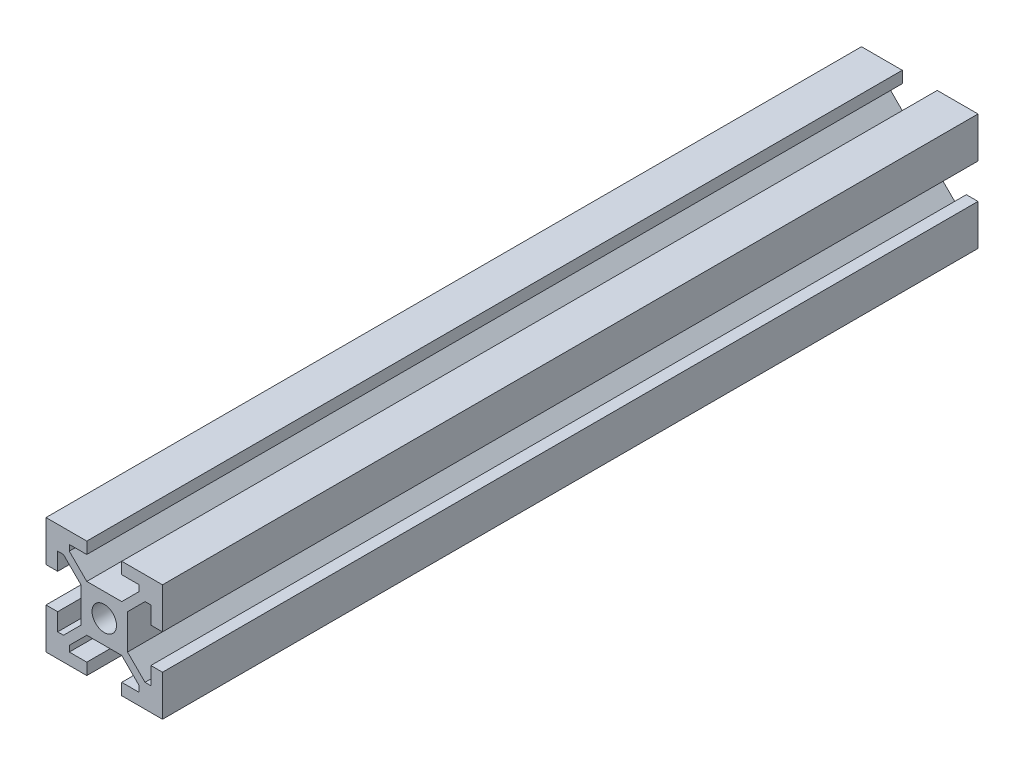
from build123d import *

# Parameters (mm, degrees)
SKETCH_2_R      = 2.1
EXTRUDE_1_DEPTH = 140


with BuildPart() as part:
    # ｽｹｯﾁ2 → ﾎﾞｽ - 押し出し1 (new body)
    with BuildSketch(Plane.XY):
        Polygon((3, 4), (-3, 4), (-6, 7), (-6, 8), (-3, 8), (-3, 10), (-10, 10), (-10, 3), (-8, 3), (-8, 6), (-7, 6), (-4, 3), (-4, -3), (-7, -6), (-8, -6), (-8, -3), (-10, -3), (-10, -10), (-3, -10), (-3, -8), (-6, -8), (-6, -7), (-3, -4), (3, -4), (6, -7), (6, -8), (3, -8), (3, -10), (10, -10), (10, -3), (8, -3), (8, -6), (7, -6), (4, -3), (4, 3), (7, 6), (8, 6), (8, 3), (10, 3), (10, 10), (3, 10), (3, 8), (6, 8), (6, 7), align=None)
        Circle(SKETCH_2_R, mode=Mode.SUBTRACT)
    extrude(amount=EXTRUDE_1_DEPTH)


solid = part.part
